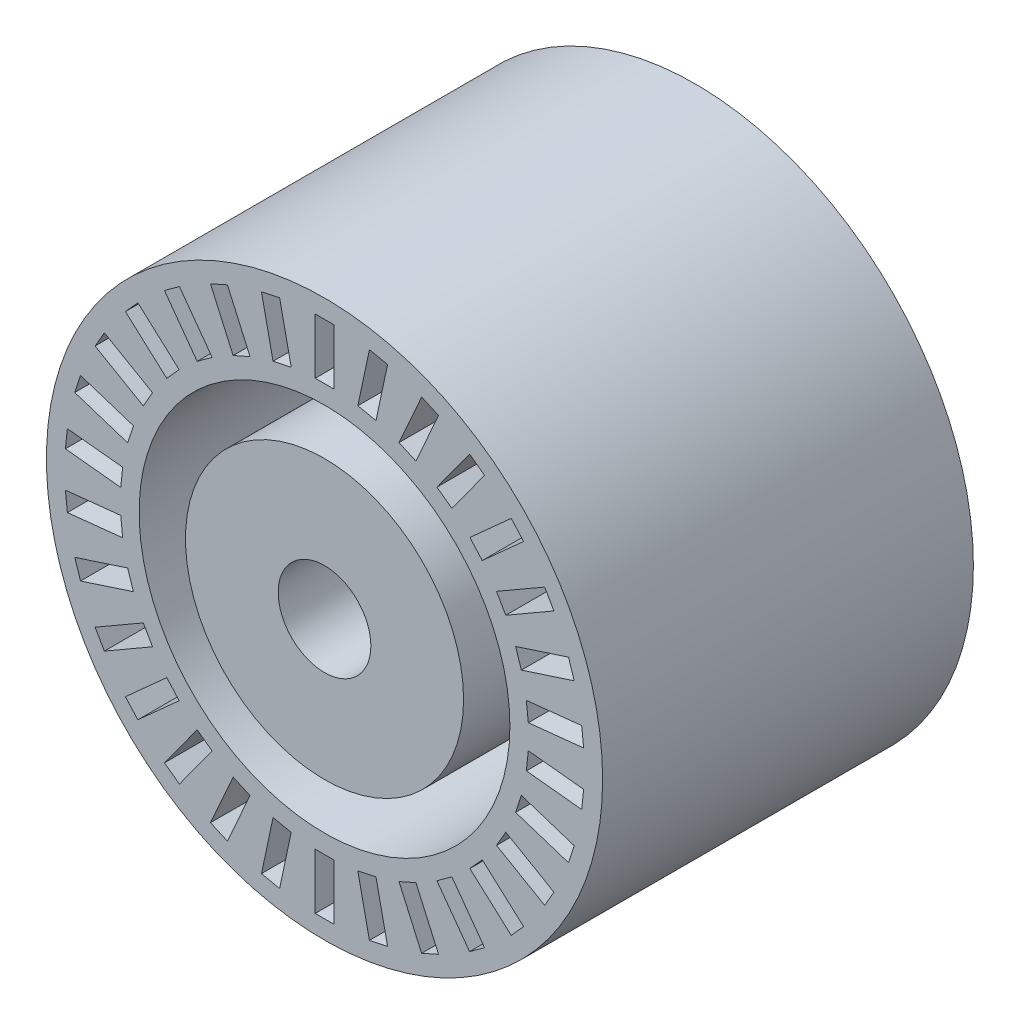
from build123d import *

# Parameters (mm, degrees)
SKETCH1_R               = 15
SKETCH1_R_2             = 2.5
BOSS_EXTRUDE1_DEPTH     = 20
SHELL1_T                = -5
SKETCH2_W               = 1
SKETCH2_H               = 3
CUT_EXTRUDE_THIN1_DEPTH = 30.154759474
CIRPATTERN1_COUNT       = 30


with BuildPart() as part:
    # Sketch1 → Boss-Extrude1 (new body)
    with BuildSketch(Plane.XY):
        Circle(SKETCH1_R)
        Circle(SKETCH1_R_2, mode=Mode.SUBTRACT)
    extrude(amount=BOSS_EXTRUDE1_DEPTH)

    # Shell1
    shell1_openings = [part.faces().sort_by_distance(p)[0] for p in [
        (-14.575735931, 0, 20),
    ]]
    offset(amount=SHELL1_T, openings=shell1_openings, kind=Kind.INTERSECTION)

    # Sketch2 → Cut-Extrude-Thin1 (cut, symmetric)
    with BuildSketch(Plane.XY):
        with Locations((0, 12.5)):
            Rectangle(SKETCH2_W, SKETCH2_H)
    cut_extrude_thin1 = extrude(amount=CUT_EXTRUDE_THIN1_DEPTH, both=True, mode=Mode.SUBTRACT)

    # CirPattern1: Cut-Extrude-Thin1 ×30 about axis
    cirpattern1_axis = Axis((0, 0, 0), (0, 0, 1))
    for i in range(1, CIRPATTERN1_COUNT):
        add(cut_extrude_thin1.rotate(cirpattern1_axis, i * 360 / CIRPATTERN1_COUNT), mode=Mode.SUBTRACT)


solid = part.part
